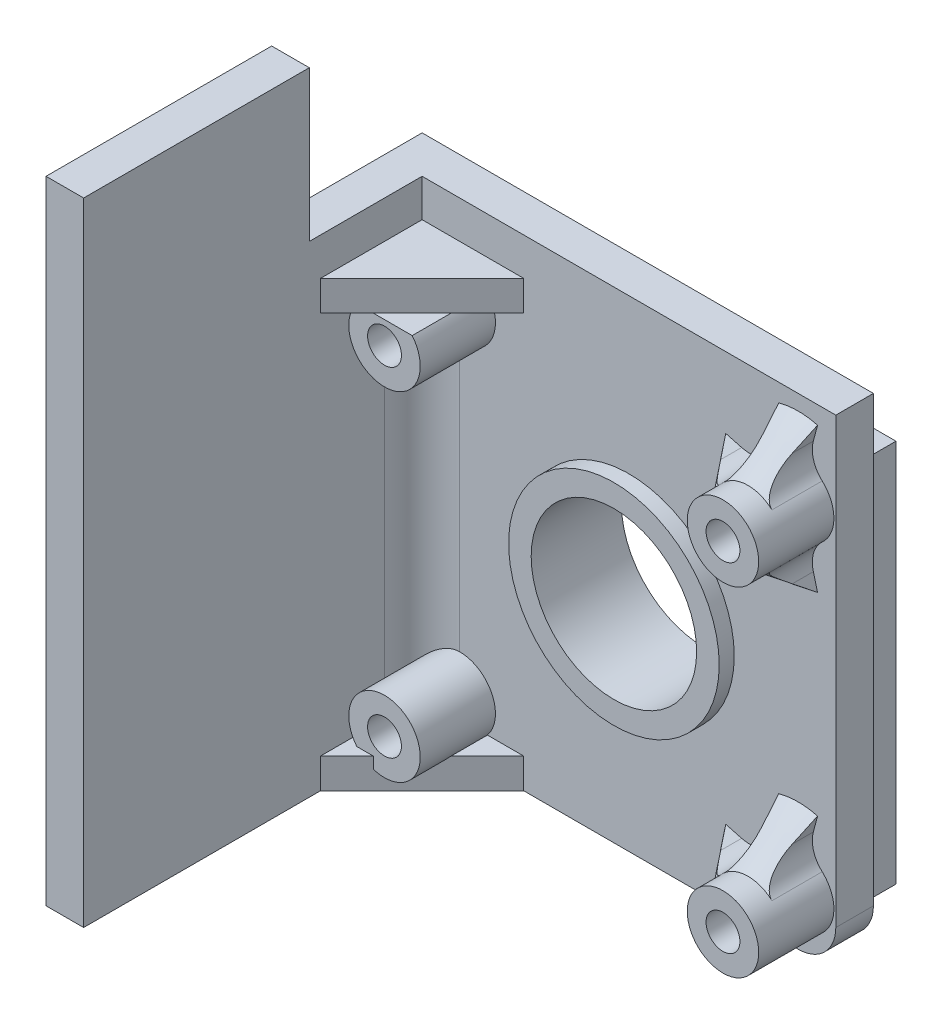
from build123d import *
from build123d.topology import SkipClean

# Parameters (mm, degrees)
SKETCH2_W            = 55
SKETCH2_H            = 59
SKETCH2_R            = 1.6
SKETCH2_R_2          = 11
BOSS_EXTRUDE1_DEPTH  = 5
SKETCH4_W            = 5
SKETCH4_H            = 59
BOSS_EXTRUDE2_DEPTH  = 50
BOSS_EXTRUDE3_DEPTH  = 4
FILLET2_R            = 5
SKETCH7_W            = 5
SKETCH7_H            = 50
BOSS_EXTRUDE4_DEPTH  = 5
BOSS_EXTRUDE5_START  = -60
SKETCH8_W            = 5
SKETCH8_H            = 5
BOSS_EXTRUDE5_DEPTH  = 55
SKETCH10_R           = 2.25
SKETCH10_R_2         = 4.75
BOSS_EXTRUDE6_DEPTH  = 10
REVOLVE1_ANGLE       = 30
CIRPATTERN1_COUNT    = 2
CIRPATTERN1_ANGLE    = 270
MIRROR1_COPY_1_ANGLE = 30
CIRPATTERN2_COUNT    = 2
CIRPATTERN2_ANGLE    = 270
SKETCH12_R           = 14
SKETCH12_R_2         = 11
BOSS_EXTRUDE7_DEPTH  = 2
FILLET3_R            = 4
SKETCH14_W           = 5
SKETCH14_H           = 30
BOSS_EXTRUDE8_DEPTH  = 20
FILLET4_R            = 5
BOSS_EXTRUDE9_START  = 5
SKETCH15_W           = 51
SKETCH15_H           = 51
SKETCH15_R           = 1.6
SKETCH15_R_2         = 11
BOSS_EXTRUDE9_DEPTH  = 5


with BuildPart() as part:
    # Sketch2 → Boss-Extrude1 (new body)
    with BuildSketch(Plane.XY):
        with Locations((22.5, 22.5)):
            Rectangle(SKETCH2_W, SKETCH2_H)
        with Locations((0, 45)):
            Circle(SKETCH2_R, mode=Mode.SUBTRACT)
        with Locations((45, 45)):
            Circle(SKETCH2_R, mode=Mode.SUBTRACT)
        with Locations((45, 0)):
            Circle(SKETCH2_R, mode=Mode.SUBTRACT)
        Circle(SKETCH2_R, mode=Mode.SUBTRACT)
        with Locations((22.5, 22.5)):
            Circle(SKETCH2_R_2, mode=Mode.SUBTRACT)
    extrude(amount=BOSS_EXTRUDE1_DEPTH)

    # Sketch4 → Boss-Extrude2 (add)
    with BuildSketch(Plane(origin=(0, 0, 0), x_dir=(-1, 0, 0), z_dir=(0, 0, -1))):
        with Locations((7.5, 22.5)):
            Rectangle(SKETCH4_W, SKETCH4_H)
    extrude(amount=-BOSS_EXTRUDE2_DEPTH)

    # Sketch5 → Boss-Extrude3 (add)
    with BuildSketch(Plane(origin=(0, 52, 0), x_dir=(1, 0, 0), z_dir=(0, 1, 0))):
        Polygon((-5, -5), (8.512790644, -5), (-5, -18.512790644), align=None)
    boss_extrude3 = extrude(amount=-BOSS_EXTRUDE3_DEPTH)

    # Fillet2
    fillet2_edges = [part.edges().sort_by_distance(p)[0] for p in [
        (50, -7, 2.5),
    ]]
    fillet(fillet2_edges, radius=FILLET2_R)

    # Sketch7 → Boss-Extrude4 (add)
    with BuildSketch(Plane(origin=(0, 52, 0), x_dir=(1, 0, 0), z_dir=(0, 1, 0))):
        with Locations((-7.5, -25)):
            Rectangle(SKETCH7_W, SKETCH7_H)
    extrude(amount=BOSS_EXTRUDE4_DEPTH)

    # Sketch8 → Boss-Extrude5 (add)
    with BuildSketch(Plane.ZY.offset(10).offset(BOSS_EXTRUDE5_START)):
        with Locations((2.5, 54.5)):
            Rectangle(SKETCH8_W, SKETCH8_H)
    extrude(amount=BOSS_EXTRUDE5_DEPTH)

    # Sketch10 → Boss-Extrude6 (add)
    # profile 1 of 4: a face of its own
    with BuildSketch(Plane.XY.offset(5)):
        with BuildLine():
            Line((3.682729966, 48), (-3.682729966, 48))
            ThreePointArc((-3.682729966, 48), (0, 40.25), (3.682729966, 48))
        make_face()
        with Locations((0, 45)):
            Circle(SKETCH10_R, mode=Mode.SUBTRACT)
    # profile 2 of 4: a face of its own
    with BuildSketch(Plane.XY.offset(5)):
        with Locations((45, 45)):
            Circle(SKETCH10_R_2)
        with Locations((45, 45)):
            Circle(SKETCH10_R, mode=Mode.SUBTRACT)
    # profile 3 of 4: a face of its own
    with BuildSketch(Plane.XY.offset(5)):
        with Locations((45, 0)):
            Circle(SKETCH10_R_2)
        with Locations((45, 0)):
            Circle(SKETCH10_R, mode=Mode.SUBTRACT)
    # profile 4 of 4: a face of its own
    with BuildSketch(Plane.XY.offset(5)):
        Circle(SKETCH10_R_2)
        Circle(SKETCH10_R, mode=Mode.SUBTRACT)
    extrude(amount=BOSS_EXTRUDE6_DEPTH)

    # Sketch11 → Revolve1 (revolve, symmetric)
    with BuildSketch(Plane(origin=(0, 45, 0), x_dir=(0, 0, -1), z_dir=(0, 1, 0))) as revolve1_sk:
        Polygon((-5, -40.25), (-5, -35.032167456), (-11.67737913, -40.25), align=None)
    revolve1 = revolve(axis=Axis((45, 45, 15), (0, 0, -1)), revolution_arc=REVOLVE1_ANGLE / 2)
    revolve1 = revolve1 + revolve(revolve1_sk.sketch, axis=Axis((45, 45, 15), (0, 0, 1)), revolution_arc=REVOLVE1_ANGLE / 2)

    # CirPattern1: Revolve1 ×2 about axis
    cirpattern1_axis = Axis((45, 45, 15), (0, 0, -1))
    for i in range(1, CIRPATTERN1_COUNT):
        add(revolve1.rotate(cirpattern1_axis, i * CIRPATTERN1_ANGLE / (CIRPATTERN1_COUNT - 1)))

    # Mirror1: Revolve1 across plane
    add(revolve1.mirror(Plane.ZX.offset(22.5)))

    # Mirror1 copy 1 sketch → Mirror1 copy 1 (revolve, symmetric)
    with BuildSketch(Plane(origin=(45, 45, 0), x_dir=(0, 0, -1), z_dir=(-1, 0, 0))) as mirror1_copy_1_sk:
        Polygon((-5, 40.25), (-5, 35.032167456), (-11.67737913, 40.25), align=None)
    revolve(axis=Axis((45, 0, 15), (0, 0, 1)), revolution_arc=MIRROR1_COPY_1_ANGLE / 2)
    revolve(mirror1_copy_1_sk.sketch, axis=Axis((45, 0, 15), (0, 0, -1)), revolution_arc=MIRROR1_COPY_1_ANGLE / 2)

    # CirPattern2: Revolve1 ×2 about axis
    cirpattern2_axis = Axis((45, 45, 15), (0, 0, 1))
    for i in range(1, CIRPATTERN2_COUNT):
        add(revolve1.rotate(cirpattern2_axis, i * CIRPATTERN2_ANGLE / (CIRPATTERN2_COUNT - 1)))

    # Sketch12 → Boss-Extrude7 (add)
    with BuildSketch(Plane.XY.offset(5)):
        with Locations((22.5, 22.5)):
            Circle(SKETCH12_R)
        with Locations((22.5, 22.5)):
            Circle(SKETCH12_R_2, mode=Mode.SUBTRACT)
    extrude(amount=BOSS_EXTRUDE7_DEPTH)

    # Mirror2: Boss-Extrude3 across plane
    add(boss_extrude3.mirror(Plane.ZX.offset(22.5)))

    # Fillet3
    fillet3_edges = [part.edges().sort_by_distance(p)[0] for p in [
        (40.411852325, 43.770609536, 8.338689565),
        (40.411852325, 46.229390464, 8.338689565),
        (46.229390464, 40.411852325, 8.338689565),
        (43.770609536, 40.411852325, 8.338689565),
        (40.411852325, -1.229390464, 8.338689565),
        (40.411852325, 1.229390464, 8.338689565),
        (43.770609536, 4.588147675, 8.338689565),
        (46.229390464, 4.588147675, 8.338689565),
        (43.770609536, 49.588147675, 8.338689565),
        (46.229390464, 49.588147675, 8.338689565),
    ]]
    fillet(fillet3_edges, radius=FILLET3_R)

    # Sketch14 → Boss-Extrude8 (add)
    with BuildSketch(Plane(origin=(0, 57, 0), x_dir=(1, 0, 0), z_dir=(0, 1, 0))):
        with Locations((-7.5, -35)):
            Rectangle(SKETCH14_W, SKETCH14_H)
    extrude(amount=BOSS_EXTRUDE8_DEPTH)

    # Fillet4
    fillet4_edges = [part.edges().sort_by_distance(p)[0] for p in [
        (-5, 22.5, 5),
    ]]
    fillet(fillet4_edges, radius=FILLET4_R)

    # Sketch15 → Boss-Extrude9 (add)
    with SkipClean():  # the faces are left unmerged after this step: merging them gives an invalid solid
        with BuildSketch(Plane(origin=(0, 0, 0), x_dir=(-1, 0, 0), z_dir=(0, 0, -1)).offset(BOSS_EXTRUDE9_START)):
            with Locations((-22.5, 22.5)):
                Rectangle(SKETCH15_W, SKETCH15_H)
            Circle(SKETCH15_R, mode=Mode.SUBTRACT)
            with Locations((0, 45)):
                Circle(SKETCH15_R, mode=Mode.SUBTRACT)
            with Locations((-45, 45)):
                Circle(SKETCH15_R, mode=Mode.SUBTRACT)
            with Locations((-45, 0)):
                Circle(SKETCH15_R, mode=Mode.SUBTRACT)
            with Locations((-22.5, 22.5)):
                Circle(SKETCH15_R_2, mode=Mode.SUBTRACT)
        extrude(amount=-BOSS_EXTRUDE9_DEPTH)


solid = part.part
